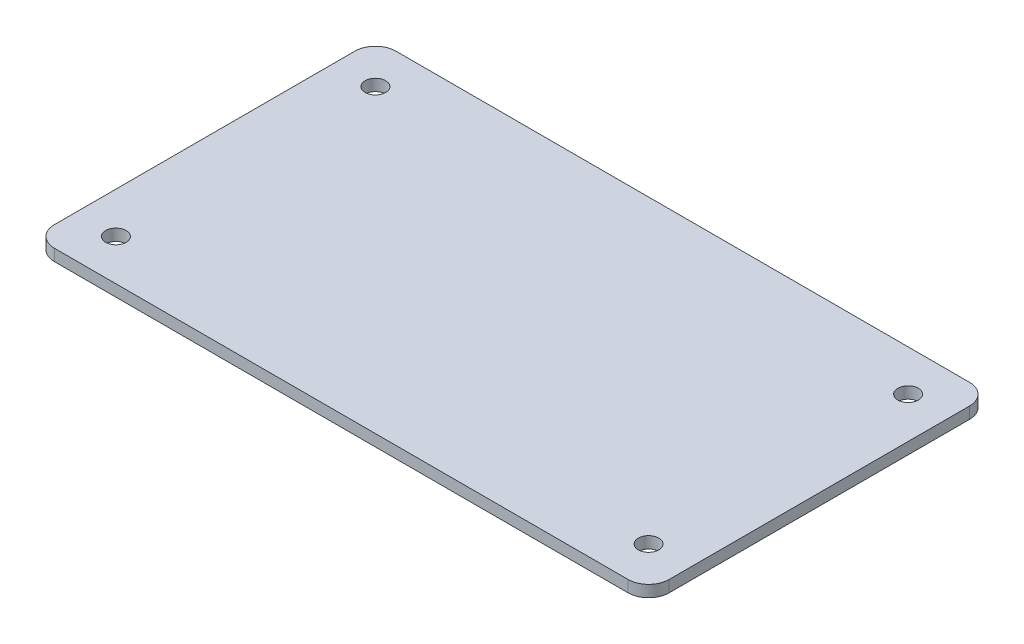
from build123d import *

# Parameters (mm, degrees)
SKETCH_1_R      = 1.5
EXTRUDE_1_DEPTH = 1.7


with BuildPart() as part:
    # 草图1 → 凸台-拉伸1 (new body)
    with BuildSketch(Plane(origin=(0, 0, 0), x_dir=(1, 0, 0), z_dir=(0, 1, 0))):
        with BuildLine():
            Line((-42, -25), (42, -25))
            ThreePointArc((42, -25), (44.121320344, -24.121320344), (45, -22))
            Line((45, -22), (45, 22))
            ThreePointArc((45, 22), (44.121320344, 24.121320344), (42, 25))
            Line((42, 25), (-42, 25))
            ThreePointArc((-42, 25), (-44.121320344, 24.121320344), (-45, 22))
            Line((-45, 22), (-45, -22))
            ThreePointArc((-45, -22), (-44.121320344, -24.121320344), (-42, -25))
        make_face()
        with Locations(Location((-39, 19, 0), (0, 0, 270))):
            Circle(SKETCH_1_R, mode=Mode.SUBTRACT)
        with Locations(Location((39, 19, 0), (0, 0, 270))):
            Circle(SKETCH_1_R, mode=Mode.SUBTRACT)
        with Locations(Location((-39, -19, 0), (0, 0, 270))):
            Circle(SKETCH_1_R, mode=Mode.SUBTRACT)
        with Locations(Location((39, -19, 0), (0, 0, 270))):
            Circle(SKETCH_1_R, mode=Mode.SUBTRACT)
    extrude(amount=EXTRUDE_1_DEPTH)


solid = part.part
